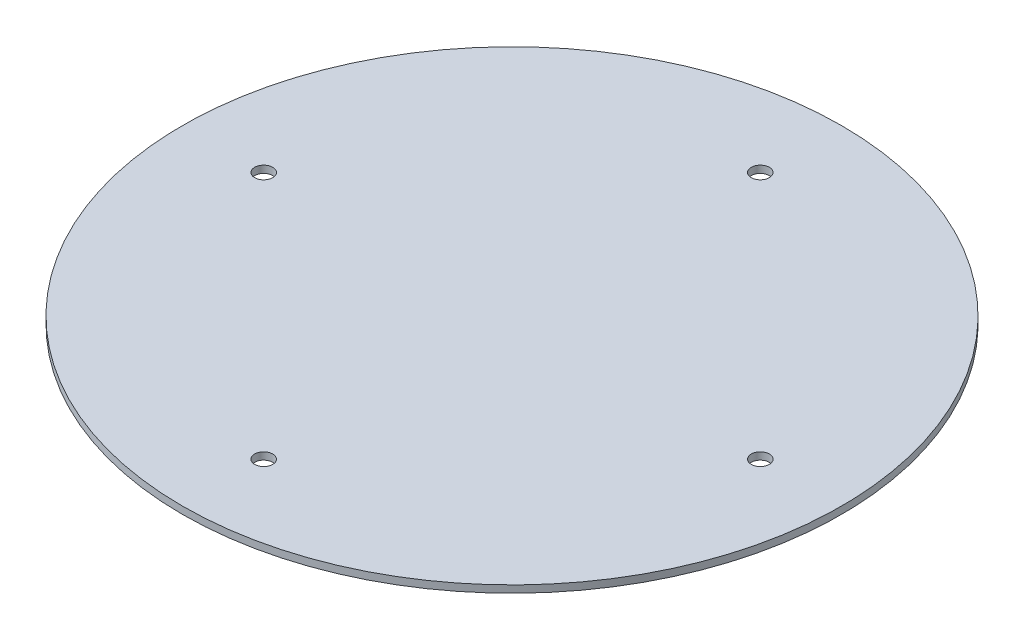
from build123d import *

# Parameters (mm, degrees)
BOSS_EXTRUDE1_DEPTH   = 1.6
F_4_0MM_DOWEL_HOLE1_D = 4


with BuildPart() as part:
    # Sketch1 → Boss-Extrude1 (new body)
    with BuildSketch(Plane(origin=(0, 0, 0), x_dir=(1, 0, 0), z_dir=(0, 1, 0))):
        with BuildLine():
            ThreePointArc((-65, 33.226495452), (-73, 0), (-65, -33.226495452))
            ThreePointArc((-65, -33.226495452), (-51.618795027, -51.618795027), (-33.226495452, -65))
            ThreePointArc((-33.226495452, -65), (0, -73), (33.226495452, -65))
            ThreePointArc((33.226495452, -65), (51.618795027, -51.618795027), (65, -33.226495452))
            ThreePointArc((65, -33.226495452), (70.971825396, -17.088007491), (73, 0))
            ThreePointArc((73, 0), (70.971825396, 17.088007491), (65, 33.226495452))
            ThreePointArc((65, 33.226495452), (51.618795027, 51.618795027), (33.226495452, 65))
            ThreePointArc((33.226495452, 65), (0, 73), (-33.226495452, 65))
            ThreePointArc((-33.226495452, 65), (-51.618795027, 51.618795027), (-65, 33.226495452))
        make_face()
    extrude(amount=BOSS_EXTRUDE1_DEPTH)

    # Ø4.0mm Dowel Hole1 (through all)
    with Locations(Plane(origin=(0, 1.6, 0), x_dir=(1, 0, 0), z_dir=(0, 1, 0))):
        with Locations((0, 55), (55, 0), (-55, 0), (0, -55)):
            Hole(F_4_0MM_DOWEL_HOLE1_D / 2)


solid = part.part
